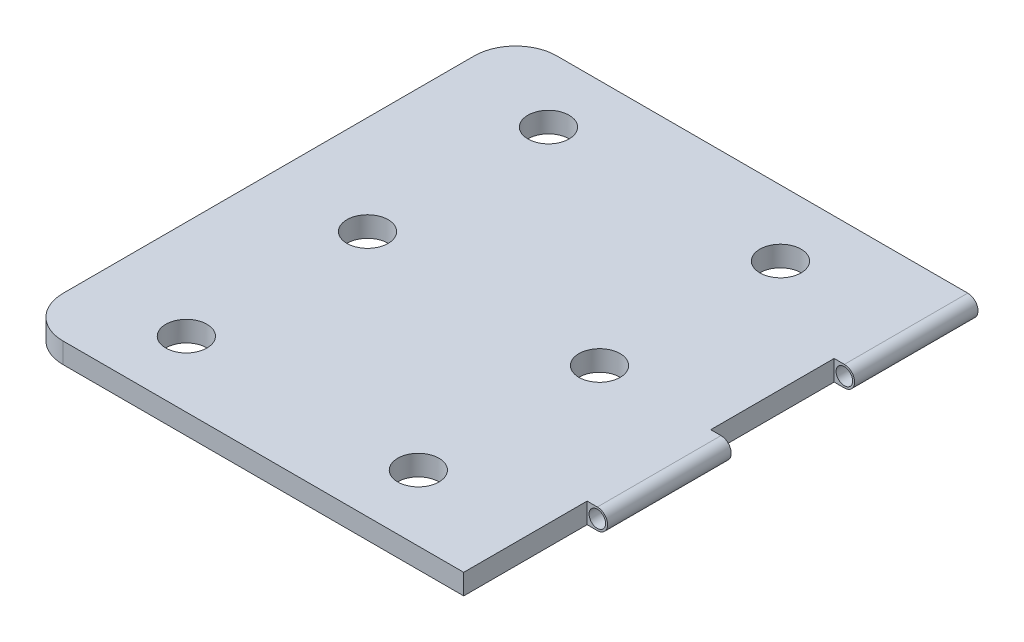
from build123d import *

# Parameters (mm, degrees)
SKETCH1_W           = 17.84
SKETCH1_H           = 19.05
BOSS_EXTRUDE1_DEPTH = 0.79
SKETCH2_R           = 0.795
SKETCH2_W           = 0.789999944
SKETCH2_H           = 4.76
CUT_EXTRUDE1_DEPTH  = 2.54
SKETCH4_R           = 0.32
CUT_EXTRUDE2_DEPTH  = 27.111150875
FILLET1_R           = 1.590000122


with BuildPart() as part:
    # Sketch1 → Boss-Extrude1 (new body)
    with BuildSketch(Plane(origin=(0, 0, 0), x_dir=(1, 0, 0), z_dir=(0, 1, 0))):
        with Locations((8.92, 9.525)):
            Rectangle(SKETCH1_W, SKETCH1_H)
    extrude(amount=BOSS_EXTRUDE1_DEPTH)

    # Sketch2 → Cut-Extrude1 (cut)
    with BuildSketch(Plane(origin=(0, 0.79, 0), x_dir=(1, 0, 0), z_dir=(0, 1, 0))):
        with Locations(Location((12.76, 2.54, 0), (0, 0, 270))):
            Circle(SKETCH2_R)
        with Locations(Location((3.81, 2.54, 0), (0, 0, 270))):
            Circle(SKETCH2_R)
        with Locations(Location((3.81, 9.53, 0), (0, 0, 270))):
            Circle(SKETCH2_R)
        with Locations(Location((12.76, 9.53, 0), (0, 0, 270))):
            Circle(SKETCH2_R)
        with Locations(Location((12.76, 16.51, 0), (0, 0, 270))):
            Circle(SKETCH2_R)
        with Locations(Location((3.81, 16.51, 0), (0, 0, 270))):
            Circle(SKETCH2_R)
        with Locations((17.445000028, 11.91)):
            Rectangle(SKETCH2_W, SKETCH2_H)
        with Locations((17.445000028, 2.38)):
            Rectangle(SKETCH2_W, SKETCH2_H)
    extrude(amount=-CUT_EXTRUDE1_DEPTH, mode=Mode.SUBTRACT)

    # Sketch4 → Cut-Extrude2 (cut, through all)
    with BuildSketch(Plane.XY):
        with Locations((17.445000028, 0.395)):
            Circle(SKETCH4_R)
        with BuildLine():
            Line((17.84, 0.79), (17.445000028, 0.79))
            ThreePointArc((17.445000028, 0.79), (17.724307207, 0.674307179), (17.840000028, 0.395))
            Line((17.84, 0.395), (17.84, 0.79))
        make_face()
        with BuildLine():
            ThreePointArc((17.840000028, 0.395), (17.724307207, 0.115692821), (17.445000028, 0))
            Line((17.445000028, 0), (17.84, 0))
            Line((17.84, 0), (17.84, 0.395))
        make_face()
    extrude(amount=-CUT_EXTRUDE2_DEPTH, mode=Mode.SUBTRACT)

    # Fillet1
    fillet1_edges = [part.edges().sort_by_distance(p)[0] for p in [
        (0, 0.395, -19.05),
        (0, 0.395, 0),
    ]]
    fillet(fillet1_edges, radius=FILLET1_R)


solid = part.part
